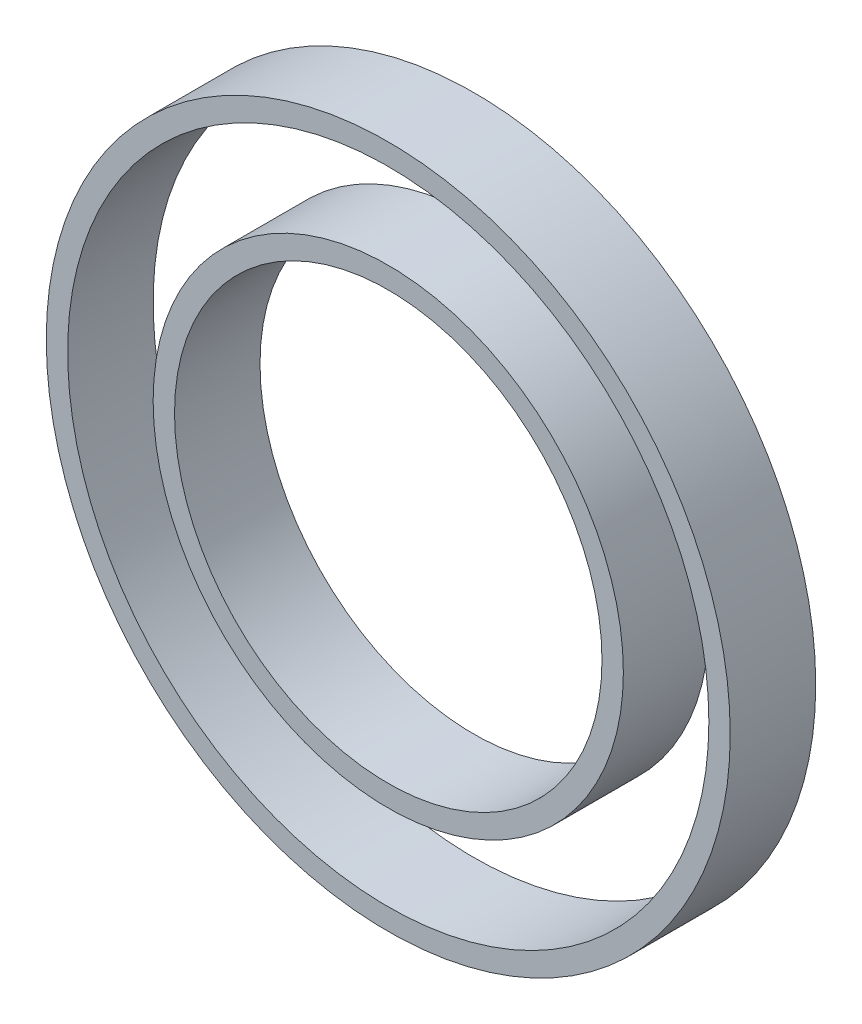
from build123d import *

# Parameters (mm, degrees)
SKETCH1_R             = 8
SKETCH1_R_2           = 7.5
BOSS_EXTRUDE1_DEPTH   = 2
SKETCH1_R_3           = 5.5
SKETCH1_R_4           = 5
BOSS_EXTRUDE1_2_DEPTH = 2


with BuildPart() as part:
    # Sketch1 → Boss-Extrude1 (new body)
    with BuildSketch(Plane.XY):
        Circle(SKETCH1_R)
        Circle(SKETCH1_R_2, mode=Mode.SUBTRACT)
    extrude(amount=BOSS_EXTRUDE1_DEPTH)


with BuildPart() as body_2:
    # Sketch1 → Boss-Extrude1 2 (new body)
    with BuildSketch(Plane.XY):
        Circle(SKETCH1_R_3)
        Circle(SKETCH1_R_4, mode=Mode.SUBTRACT)
    extrude(amount=BOSS_EXTRUDE1_2_DEPTH)


solid = Compound([part.part, body_2.part])
